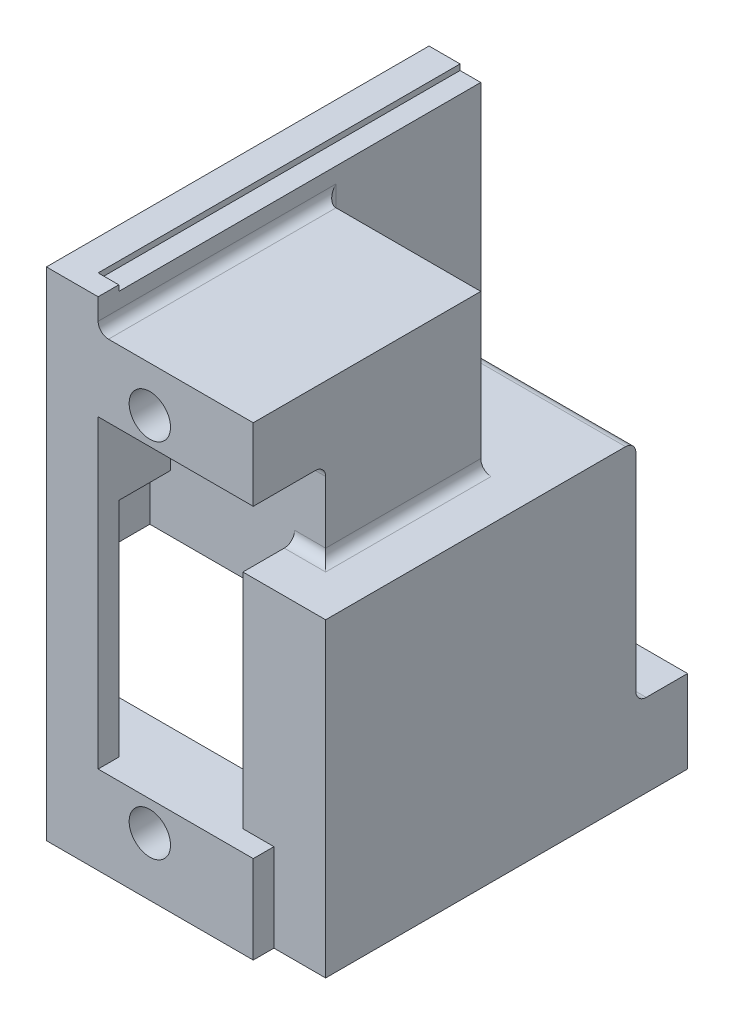
from build123d import *

# Parameters (mm, degrees)
SKETCH_2_W                                 = 30
SKETCH_2_H                                 = 30
EXTRUDE_2_DEPTH                            = 15
SKETCH_3_W                                 = 21
SKETCH_3_H                                 = 25
CUT_EXTRUDE_1_DEPTH                        = 24.5
SKETCH_4_R                                 = 5
CUT_EXTRUDE_2_DEPTH                        = 37.742346142
EXTRUDE_3_DEPTH                            = 2.5
SKETCH_6_W                                 = 14
SKETCH_6_H                                 = 30
CUT_EXTRUDE_3_DEPTH                        = 5
SKETCH_8_R                                 = 2
CUT_EXTRUDE_4_DEPTH                        = 2.5
EXTRUDE_4_DEPTH                            = 10
MIRROR_18_AT_THE_SECOND_PLANE_COPY_1_SKE_W = 30
MIRROR_18_AT_THE_SECOND_PLANE_COPY_1_SKE_H = 30
MIRROR_18_AT_THE_SECOND_PLANE_COPY_1_DEPTH = 15
MIRROR_18_AT_THE_SECOND_PLANE_COPY_2_SKE_W = 21
MIRROR_18_AT_THE_SECOND_PLANE_COPY_2_SKE_H = 25
MIRROR_18_AT_THE_SECOND_PLANE_COPY_2_DEPTH = 24.5
MIRROR_18_AT_THE_SECOND_PLANE_COPY_3_SKE_R = 5
MIRROR_18_AT_THE_SECOND_PLANE_COPY_3_DEPTH = 37.742346142
MIRROR_14_AT_THE_SECOND_PLANE_COPY_1_DEPTH = 2.5
MIRROR_14_AT_THE_SECOND_PLANE_COPY_2_SKE_R = 2
MIRROR_14_AT_THE_SECOND_PLANE_COPY_2_DEPTH = 2.5
MIRROR_19_AT_THE_SECOND_PLANE_COPY_1_SKE_W = 14
MIRROR_19_AT_THE_SECOND_PLANE_COPY_1_SKE_H = 30
MIRROR_19_AT_THE_SECOND_PLANE_COPY_1_DEPTH = 5
SKETCH_10_W                                = 90
SKETCH_10_H                                = 8
EXTRUDE_5_DEPTH                            = 30
EXTRUDE_6_DEPTH                            = 15
EXTRUDE_6_DEPTH_BACK                       = 10
SKETCH_11_W                                = 7
SKETCH_11_H                                = 8.5
SKETCH_12_W                                = 140
SKETCH_12_H                                = 45
CUT_EXTRUDE_5_DEPTH                        = 2
SKETCH_15_R                                = 2.5
SKETCH_15_W                                = 15
SKETCH_15_H                                = 40
SKETCH_15_W_2                              = 25
SKETCH_15_H_2                              = 11.861851271
CUT_EXTRUDE_7_DEPTH                        = 201.124960962
SKETCH_14_R                                = 2
CUT_EXTRUDE_6_DEPTH                        = 5
FILLET_1_R                                 = 5
SKETCH_17_R                                = 2
CUT_EXTRUDE_8_DEPTH                        = 5
SKETCH_14_6_R                              = 2
CUT_EXTRUDE_9_DEPTH                        = 25
SKETCH_18_R                                = 4.3
CUT_EXTRUDE_10_DEPTH                       = 6
FILLET_2_R                                 = 1
CUT_EXTRUDE_11_DEPTH                       = 171.73371079
CUT_EXTRUDE_11_DEPTH_BACK                  = 171.73371079
SKETCH_19_W                                = 5
SKETCH_19_H                                = 200
CUT_EXTRUDE_12_DEPTH                       = 201.686322404


with BuildPart() as part:
    # 草圖2 → 填料-伸長2 (new, symmetric)
    with BuildSketch(Plane.XY):
        Rectangle(SKETCH_2_W, SKETCH_2_H)
    extrude_2 = extrude(amount=EXTRUDE_2_DEPTH, both=True)

    # 草圖3 → 除料-伸長1 (cut)
    with BuildSketch(Plane(origin=(0, 15, 0), x_dir=(1, 0, 0), z_dir=(0, 1, 0))):
        with Locations((-4.5, 2.5)):
            Rectangle(SKETCH_3_W, SKETCH_3_H)
    cut_extrude_1 = extrude(amount=-CUT_EXTRUDE_1_DEPTH, mode=Mode.SUBTRACT)

    # 草圖4 → 除料-伸長2 (cut, through all)
    with BuildSketch(Plane.XY.offset(15)):
        Circle(SKETCH_4_R)
    cut_extrude_2 = extrude(amount=-CUT_EXTRUDE_2_DEPTH, mode=Mode.SUBTRACT)

    # 草圖6 → 除料-伸長3 (cut)
    with BuildSketch(Plane(origin=(0, 0, -15), x_dir=(-1, 0, 0), z_dir=(0, 0, -1))):
        Rectangle(SKETCH_6_W, SKETCH_6_H)
    cut_extrude_3 = extrude(amount=-CUT_EXTRUDE_3_DEPTH, mode=Mode.SUBTRACT)

    # 草圖9 → 填料-伸長4 (add)
    with BuildSketch(Plane.ZY.offset(15)):
        Polygon((-45, 15), (-10, 15), (-10, -9.5), (10, -9.5), (10, 15), (100, 15), (100, -9.5), (120, -9.5), (120, 15), (155, 15), (155, -125), (120, -125), (120, -100.5), (100, -100.5), (100, -125), (10, -125), (10, -100.5), (-10, -100.5), (-10, -125), (-45, -125), align=None)
    extrude(amount=-EXTRUDE_4_DEPTH)

    # 鏡射18: 填料-伸長2, 除料-伸長1, 除料-伸長2 across plane
    add(extrude_2.mirror(Plane.ZX.offset(-55)))
    add(cut_extrude_1.mirror(Plane.ZX.offset(-55)), mode=Mode.SUBTRACT)
    add(cut_extrude_2.mirror(Plane.ZX.offset(-55)), mode=Mode.SUBTRACT)

    # 鏡射18 at the second plane: 填料-伸長2, 除料-伸長1, 除料-伸長2 across plane
    add(extrude_2.mirror(Plane.XY.offset(55)))
    add(cut_extrude_1.mirror(Plane.XY.offset(55)), mode=Mode.SUBTRACT)
    add(cut_extrude_2.mirror(Plane.XY.offset(55)), mode=Mode.SUBTRACT)

    # 鏡射18 at the second plane copy 1 ske → 鏡射18 at the second plane copy 1 (add, symmetric)
    with BuildSketch(Plane(origin=(0, -110, 110), x_dir=(1, 0, 0), z_dir=(0, 0, -1))):
        Rectangle(MIRROR_18_AT_THE_SECOND_PLANE_COPY_1_SKE_W, MIRROR_18_AT_THE_SECOND_PLANE_COPY_1_SKE_H)
    extrude(amount=MIRROR_18_AT_THE_SECOND_PLANE_COPY_1_DEPTH, both=True)

    # 鏡射18 at the second plane copy 2 ske → 鏡射18 at the second plane copy 2 (cut)
    with BuildSketch(Plane(origin=(0, -125, 110), x_dir=(1, 0, 0), z_dir=(0, -1, 0))):
        with Locations((-4.5, 2.5)):
            Rectangle(MIRROR_18_AT_THE_SECOND_PLANE_COPY_2_SKE_W, MIRROR_18_AT_THE_SECOND_PLANE_COPY_2_SKE_H)
    extrude(amount=-MIRROR_18_AT_THE_SECOND_PLANE_COPY_2_DEPTH, mode=Mode.SUBTRACT)

    # 鏡射18 at the second plane copy 3 ske → 鏡射18 at the second plane copy 3 (cut, through all)
    with BuildSketch(Plane(origin=(0, -110, 95), x_dir=(1, 0, 0), z_dir=(0, 0, -1))):
        Circle(MIRROR_18_AT_THE_SECOND_PLANE_COPY_3_SKE_R)
    extrude(amount=-MIRROR_18_AT_THE_SECOND_PLANE_COPY_3_DEPTH, mode=Mode.SUBTRACT)


with BuildPart() as body_2:
    # 草圖5 → 填料-伸長3 (new, symmetric)
    with BuildSketch(Plane.XY):
        with BuildLine():
            Line((0, 14), (6, 14))
            Line((6, 14), (6, 6))
            Line((6, 6), (6, 3))
            Line((6, 3), (0, 6))
            ThreePointArc((0, 6), (-4, 10), (0, 14))
        make_face()
    extrude_3 = extrude(amount=EXTRUDE_3_DEPTH, both=True)

    # 草圖8 → 除料-伸長4 (cut, symmetric)
    with BuildSketch(Plane.XY):
        with Locations((0, 10)):
            Circle(SKETCH_8_R)
    cut_extrude_4 = extrude(amount=CUT_EXTRUDE_4_DEPTH, both=True, mode=Mode.SUBTRACT)


with BuildPart() as part_1:
    add(part.part)

    # 鏡射14: 填料-伸長3, 除料-伸長4 across plane
    add(extrude_3.mirror(Plane.ZX.offset(-55)))
    add(cut_extrude_4.mirror(Plane.ZX.offset(-55)), mode=Mode.SUBTRACT)

    # 鏡射14 at the second plane: 填料-伸長3, 除料-伸長4 across plane
    add(extrude_3.mirror(Plane.XY.offset(55)))
    add(cut_extrude_4.mirror(Plane.XY.offset(55)), mode=Mode.SUBTRACT)

    # 鏡射14 at the second plane copy 1 ske → 鏡射14 at the second plane copy 1 (add, symmetric)
    with BuildSketch(Plane(origin=(0, -110, 110), x_dir=(1, 0, 0), z_dir=(0, 0, -1))):
        with BuildLine():
            Line((0, 14), (6, 14))
            Line((6, 14), (6, 6))
            Line((6, 6), (6, 3))
            Line((6, 3), (0, 6))
            ThreePointArc((0, 6), (-4, 10), (0, 14))
        make_face()
    extrude(amount=MIRROR_14_AT_THE_SECOND_PLANE_COPY_1_DEPTH, both=True)

    # 鏡射14 at the second plane copy 2 ske → 鏡射14 at the second plane copy 2 (cut, symmetric)
    with BuildSketch(Plane(origin=(0, -110, 110), x_dir=(1, 0, 0), z_dir=(0, 0, -1))):
        with Locations((0, 10)):
            Circle(MIRROR_14_AT_THE_SECOND_PLANE_COPY_2_SKE_R)
    extrude(amount=MIRROR_14_AT_THE_SECOND_PLANE_COPY_2_DEPTH, both=True, mode=Mode.SUBTRACT)

    # 鏡射19: 除料-伸長3 across plane
    add(cut_extrude_3.mirror(Plane.XY.offset(55)), mode=Mode.SUBTRACT)

    # 鏡射19 at the second plane: 除料-伸長3 across plane
    add(cut_extrude_3.mirror(Plane.ZX.offset(-55)), mode=Mode.SUBTRACT)

    # 鏡射19 at the second plane copy 1 ske → 鏡射19 at the second plane copy 1 (cut)
    with BuildSketch(Plane(origin=(0, -110, 125), x_dir=(-1, 0, 0), z_dir=(0, 0, 1))):
        Rectangle(MIRROR_19_AT_THE_SECOND_PLANE_COPY_1_SKE_W, MIRROR_19_AT_THE_SECOND_PLANE_COPY_1_SKE_H)
    extrude(amount=-MIRROR_19_AT_THE_SECOND_PLANE_COPY_1_DEPTH, mode=Mode.SUBTRACT)

    # 草圖10 → 填料-伸長5 (add)
    with BuildSketch(Plane.ZY.offset(15)):
        with Locations((55, 11)):
            Rectangle(SKETCH_10_W, SKETCH_10_H)
        with Locations((55, -121)):
            Rectangle(SKETCH_10_W, SKETCH_10_H)
    extrude(amount=-EXTRUDE_5_DEPTH)

    # 草圖11 → 填料-伸長6 (add, two sides: drawn at the far end of the back side and taken through both)
    with BuildSketch(Plane(origin=(-5, 0, 0), x_dir=(0, 0, -1), z_dir=(1, 0, 0)).offset(-EXTRUDE_6_DEPTH_BACK)):
        with Locations((13.5, 10.75)):
            Rectangle(SKETCH_11_W, SKETCH_11_H)
        with Locations((13.5, -120.75)):
            Rectangle(SKETCH_11_W, SKETCH_11_H)
        Polygon((12.973156493, -80), (17, -80), (17, -87), (10, -87), (10, -95), (-5, -95), (-5, -80), align=None)
        with Locations((-123.5, -120.75)):
            Rectangle(SKETCH_11_W, SKETCH_11_H)
        Polygon((-120, -87), (-127, -87), (-127, -80), (-122.973156493, -80), (-105, -80), (-105, -95), (-120, -95), align=None)
        Polygon((10, -23), (17, -23), (17, -30), (12.973156493, -30), (-5, -30), (-5, -15), (10, -15), align=None)
        Polygon((-122.973156493, -30), (-127, -30), (-127, -23), (-120, -23), (-120, -15), (-105, -15), (-105, -30), align=None)
        with Locations((-123.5, 10.75)):
            Rectangle(SKETCH_11_W, SKETCH_11_H)
    extrude(amount=EXTRUDE_6_DEPTH + EXTRUDE_6_DEPTH_BACK)

    # 草圖12 → 除料-伸長5 (cut)
    with BuildSketch(Plane(origin=(-5, 0, 0), x_dir=(0, 0, -1), z_dir=(1, 0, 0))):
        with Locations((-55, -55)):
            Rectangle(SKETCH_12_W, SKETCH_12_H)
    extrude(amount=-CUT_EXTRUDE_5_DEPTH, mode=Mode.SUBTRACT)

    # 草圖15 → 除料-伸長7 (cut, through all)
    with BuildSketch(Plane(origin=(-5, 0, 0), x_dir=(0, 0, -1), z_dir=(1, 0, 0))):
        with Locations(Location((30, -90, 0), (0, 0, 270))):
            Circle(SKETCH_15_R)
        with Locations(Location((-55, -90, 0), (0, 0, 270))):
            Circle(SKETCH_15_R)
        with Locations(Location((-140, -90, 0), (0, 0, 270))):
            Circle(SKETCH_15_R)
        with Locations(Location((-140, -20, 0), (0, 0, 90))):
            Circle(SKETCH_15_R)
        with Locations(Location((30, -20, 0), (0, 0, 90))):
            Circle(SKETCH_15_R)
        with Locations(Location((-55, -20, 0), (0, 0, 90))):
            Circle(SKETCH_15_R)
        with Locations((-139.005709801, -55)):
            Rectangle(SKETCH_15_W, SKETCH_15_H)
        with Locations((29.005709801, -55)):
            Rectangle(SKETCH_15_W, SKETCH_15_H)
        with Locations((-77.5, -30)):
            Rectangle(SKETCH_15_W_2, SKETCH_15_H)
        with Locations((-77.5, -80)):
            Rectangle(SKETCH_15_W_2, SKETCH_15_H)
        with Locations((-32.5, -80)):
            Rectangle(SKETCH_15_W_2, SKETCH_15_H)
        with Locations((-32.5, -30)):
            Rectangle(SKETCH_15_W_2, SKETCH_15_H)
        with Locations((-139.005709801, -106.804819835)):
            Rectangle(SKETCH_15_W, SKETCH_15_H_2)
        with Locations((-139.005709801, -3.195180166)):
            Rectangle(SKETCH_15_W, SKETCH_15_H_2)
        with Locations((29.005709801, -106.804819835)):
            Rectangle(SKETCH_15_W, SKETCH_15_H_2)
        with Locations((29.005709801, -3.195180166)):
            Rectangle(SKETCH_15_W, SKETCH_15_H_2)
    extrude(amount=-CUT_EXTRUDE_7_DEPTH, mode=Mode.SUBTRACT)

    # 草圖14 → 除料-伸長6 (cut)
    with BuildSketch(Plane(origin=(15, 0, 0), x_dir=(0, 0, -1), z_dir=(1, 0, 0))):
        with Locations(Location((-55, 11, 0), (0, 0, 90))):
            Circle(SKETCH_14_R)
        with Locations(Location((-55, -121, 0), (0, 0, 270))):
            Circle(SKETCH_14_R)
    extrude(amount=-CUT_EXTRUDE_6_DEPTH, mode=Mode.SUBTRACT)

    # 圓角1
    fillet_1_edges = [part_1.edges().sort_by_distance(p)[0] for p in [
        (-10, -125, -45),
        (-10, 15, -45),
        (-10, 15, 155),
        (-10, -125, 155),
        (-10, -75, 146.505709801),
        (-10, -35, 146.505709801),
        (-10, -35, 131.505709801),
        (-10, -75, 131.505709801),
        (-10, -35, -36.505709801),
        (-10, -75, -36.505709801),
        (-10, -75, -21.505709801),
        (-10, -35, -21.505709801),
    ]]
    fillet(fillet_1_edges, radius=FILLET_1_R)

    # 草圖17 → 除料-伸長8 (cut)
    with BuildSketch(Plane(origin=(0, 0, -17), x_dir=(-1, 0, 0), z_dir=(0, 0, -1))):
        with Locations(Location((0, 9.38, 0), (0, 0, 90))):
            Circle(SKETCH_17_R)
        with Locations(Location((0, -25.62, 0), (0, 0, 90))):
            Circle(SKETCH_17_R)
        with Locations(Location((0, -84.38, 0), (0, 0, 270))):
            Circle(SKETCH_17_R)
        with Locations(Location((0, -119.38, 0), (0, 0, 270))):
            Circle(SKETCH_17_R)
    cut_extrude_8 = extrude(amount=-CUT_EXTRUDE_8_DEPTH, mode=Mode.SUBTRACT)

    # 鏡射20: 除料-伸長8 across plane
    add(cut_extrude_8.mirror(Plane.XY.offset(55)), mode=Mode.SUBTRACT)

    # 草圖14<6> → 除料-伸長9 (cut)
    with BuildSketch(Plane(origin=(15, 0, 0), x_dir=(0, 0, -1), z_dir=(1, 0, 0))):
        with Locations(Location((39, 9, 0), (0, 0, 90))):
            Circle(SKETCH_14_6_R)
        with Locations(Location((-149, 9, 0), (0, 0, 270))):
            Circle(SKETCH_14_6_R)
        with Locations(Location((39, -119, 0), (0, 0, 270))):
            Circle(SKETCH_14_6_R)
        with Locations(Location((-149, -119, 0), (0, 0, 90))):
            Circle(SKETCH_14_6_R)
    extrude(amount=-CUT_EXTRUDE_9_DEPTH, mode=Mode.SUBTRACT)

    # 草圖18 → 除料-伸長10 (cut)
    with BuildSketch(Plane(origin=(-5, 0, 0), x_dir=(0, 0, -1), z_dir=(1, 0, 0))):
        with Locations(Location((30, -90, 0), (0, 0, 90))):
            Circle(SKETCH_18_R)
        with Locations(Location((-55, -90, 0), (0, 0, 90))):
            Circle(SKETCH_18_R)
        with Locations(Location((-140, -90, 0), (0, 0, 90))):
            Circle(SKETCH_18_R)
        with Locations(Location((-140, -20, 0), (0, 0, 90))):
            Circle(SKETCH_18_R)
        with Locations(Location((-55, -20, 0), (0, 0, 90))):
            Circle(SKETCH_18_R)
        with Locations(Location((30, -20, 0), (0, 0, 90))):
            Circle(SKETCH_18_R)
    extrude(amount=-CUT_EXTRUDE_10_DEPTH, mode=Mode.SUBTRACT)

    # 圓角2
    fillet_2_edges = [part_1.edges().sort_by_distance(p)[0] for p in [
        (5, -15, 95),
        (5, -95, 15),
        (5, -95, 95),
        (-5, 7, 55),
        (5, 7, 15),
        (5, 7, 95),
        (-5, -117, 55),
        (5, -117, 15),
        (5, -117, 95),
        (-5, -80, 116),
        (2.5, -87, 120),
        (8.5, -95, 120),
        (-5, -87.5, 105),
        (10, -95, 112.5),
        (-5, -22.5, 105),
        (-5, -30, 116),
        (2.5, -23, 120),
        (8.5, -15, 120),
        (10, -15, 112.5),
        (-5, -30, -6),
        (8.5, -15, -10),
        (2.5, -23, -10),
        (10, -15, -2.5),
        (5, -15, 15),
        (-5, -80, -6),
        (2.5, -87, -10),
        (8.5, -95, -10),
        (10, -95, -2.5),
    ]]
    fillet(fillet_2_edges, radius=FILLET_2_R)

    # 草圖19 → 除料-伸長11 (cut, two sides: drawn at the far end of the back side and taken through both)
    with BuildSketch(Plane(origin=(0, -55, 0), x_dir=(1, 0, 0), z_dir=(0, 1, 0)).offset(-CUT_EXTRUDE_11_DEPTH_BACK)):
        Polygon((-5, -20), (-5, -38.623236893), (10, -20), align=None)
        Polygon((10, -26.376763107), (-5, -45), (10, -45), align=None)
        Polygon((10, -90), (-5, -90), (-5, -71.376763107), align=None)
        Polygon((-5, -65), (10, -65), (10, -83.623236893), align=None)
        with Locations((-12.5, -55)):
            Rectangle(SKETCH_19_W, SKETCH_19_H)
    extrude(amount=CUT_EXTRUDE_11_DEPTH + CUT_EXTRUDE_11_DEPTH_BACK, mode=Mode.SUBTRACT)


with BuildPart() as cut_extrude_12_tool:
    # 草圖20 → 除料-伸長12 (new, through all)
    with BuildSketch(Plane(origin=(15, 0, 0), x_dir=(0, 0, -1), z_dir=(1, 0, 0))):
        Polygon((-127, -125), (-127, -76.948600706), (-90, -76.948600706), (-90, -125), (55.024722499, -125), (55.024722499, 33.114224964), (-156.187885381, 33.114224964), (-156.187885381, -125), align=None)
    extrude(amount=-CUT_EXTRUDE_12_DEPTH)


with BuildPart() as part_2:
    add(part_1.part)

    # 除料-伸長12: cut by cut_extrude_12_tool
    add(cut_extrude_12_tool.part, mode=Mode.SUBTRACT)


with BuildPart() as body_2_1:
    add(body_2.part)

    # 除料-伸長12: cut by cut_extrude_12_tool
    add(cut_extrude_12_tool.part, mode=Mode.SUBTRACT)


solid = part_2.part
